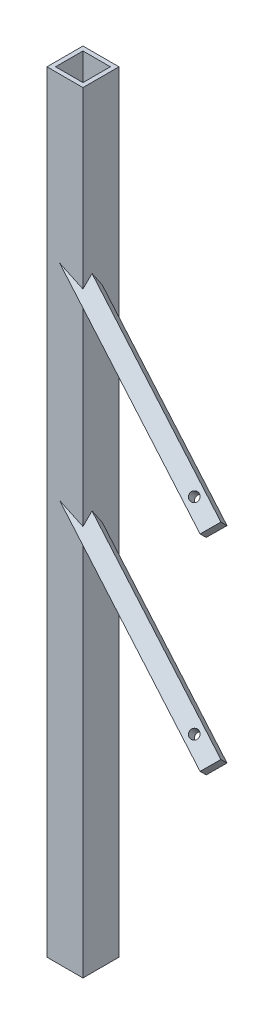
from build123d import *

# Parameters (mm, degrees)
BOSS_EXTRUDE1_DEPTH      = 250
BOSS_EXTRUDE1_DEPTH_BACK = 200
SKETCH2_W                = 21
SKETCH2_H                = 21
SKETCH3_W                = 16
SKETCH3_H                = 16
CUT_EXTRUDE1_DEPTH       = 800
SKETCH14_R               = 2.5
BOSS_EXTRUDE3_DEPTH      = 10
LPATTERN1_COUNT          = 2
LPATTERN1_PITCH          = 120


with BuildPart() as part:
    # Sketch2 → Boss-Extrude1 (new, two sides: drawn at the far end of the back side and taken through both)
    with BuildSketch(Plane(origin=(0, 0, 0), x_dir=(1, 0, 0), z_dir=(0, 1, 0)).offset(-BOSS_EXTRUDE1_DEPTH_BACK)):
        Rectangle(SKETCH2_W, SKETCH2_H)
    extrude(amount=BOSS_EXTRUDE1_DEPTH + BOSS_EXTRUDE1_DEPTH_BACK)

    # Sketch3 → Cut-Extrude1 (cut)
    with BuildSketch(Plane.XZ.offset(200)):
        Rectangle(SKETCH3_W, SKETCH3_H)
    extrude(amount=-CUT_EXTRUDE1_DEPTH, mode=Mode.SUBTRACT)

    # Sketch14 → Boss-Extrude3 (add)
    with BuildSketch(Plane(origin=(9.15884387, 19.641204062, 19.641204062), x_dir=(0.9497051253149476, -0.22142738646170096, -0.2214273864617029), z_dir=(0.3131456130149675, 0.6715429342378182, 0.6715429342378204))):
        Polygon((-12.902384486, 16.967939861), (98.008310235, -50.846644091), (103.224816692, -42.31505219), (-7.685878028, 25.499531762), align=None)
        with Locations(Location((87.819175611, -38.756088454, 0), (0, 0, 270))):
            Circle(SKETCH14_R, mode=Mode.SUBTRACT)
    boss_extrude3 = extrude(amount=-BOSS_EXTRUDE3_DEPTH)

    # LPattern1: Boss-Extrude3 ×2
    with Locations(*[(0, i * LPATTERN1_PITCH, 0) for i in range(1, LPATTERN1_COUNT)]):
        add(boss_extrude3)


solid = part.part
